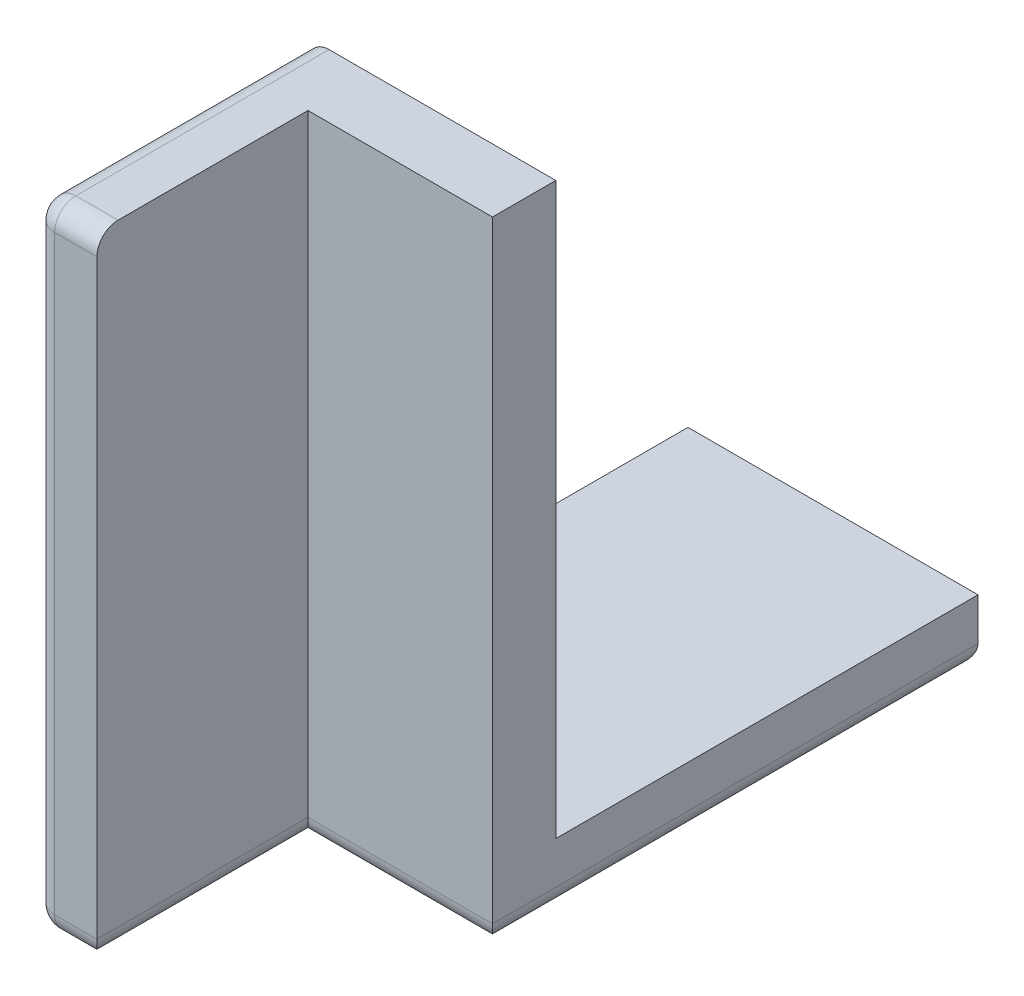
from build123d import *

# Parameters (mm, degrees)
SKETCH1_W            = 8.74
SKETCH1_H            = 30
BOSS_EXTRUDE1_DEPTH  = 3
SKETCH8_W            = 8.74
SKETCH8_H            = 3
BOSS_EXTRUDE7_DEPTH  = 20
SKETCH9_W            = 20
SKETCH9_H            = 3
BOSS_EXTRUDE8_DEPTH  = 5
SKETCH12_W           = 3
SKETCH12_H           = 30
BOSS_EXTRUDE10_DEPTH = 3
SKETCH13_W           = 3
SKETCH13_H           = 30
BOSS_EXTRUDE11_DEPTH = 10
FILLET6_R            = 1


with BuildPart() as part:
    # Sketch1 → Boss-Extrude1 (new body)
    with BuildSketch(Plane.XY):
        with Locations((4.37, -15)):
            Rectangle(SKETCH1_W, SKETCH1_H)
    extrude(amount=BOSS_EXTRUDE1_DEPTH)

    # Sketch8 → Boss-Extrude7 (add)
    with BuildSketch(Plane(origin=(0, 0, 0), x_dir=(-1, 0, 0), z_dir=(0, 0, -1))):
        with Locations((-4.37, -28.5)):
            Rectangle(SKETCH8_W, SKETCH8_H)
    extrude(amount=BOSS_EXTRUDE7_DEPTH)

    # Sketch9 → Boss-Extrude8 (add)
    with BuildSketch(Plane.ZY):
        with Locations((-10, -28.5)):
            Rectangle(SKETCH9_W, SKETCH9_H)
    extrude(amount=BOSS_EXTRUDE8_DEPTH)

    # Sketch12 → Boss-Extrude10 (add)
    with BuildSketch(Plane.ZY):
        with Locations((1.5, -15)):
            Rectangle(SKETCH12_W, SKETCH12_H)
    extrude(amount=BOSS_EXTRUDE10_DEPTH)

    # Sketch13 → Boss-Extrude11 (add)
    with BuildSketch(Plane.XY.offset(3)):
        with Locations((-1.5, -15)):
            Rectangle(SKETCH13_W, SKETCH13_H)
    extrude(amount=BOSS_EXTRUDE11_DEPTH)

    # Fillet6
    fillet6_edges = [part.edges().sort_by_distance(p)[0] for p in [
        (1.87, -30, -20),
        (-4, -30, 0),
        (-5, -30, -10),
        (-5, -28.5, 0),
        (-3, 0, 6.5),
        (-3, -30, 6.5),
        (4.37, -30, 3),
        (0, -30, 8),
        (-1.5, 0, 13),
        (-3, -15, 13),
        (-1.5, -30, 13),
        (8.74, -30, -8.5),
    ]]
    fillet(fillet6_edges, radius=FILLET6_R)


solid = part.part
